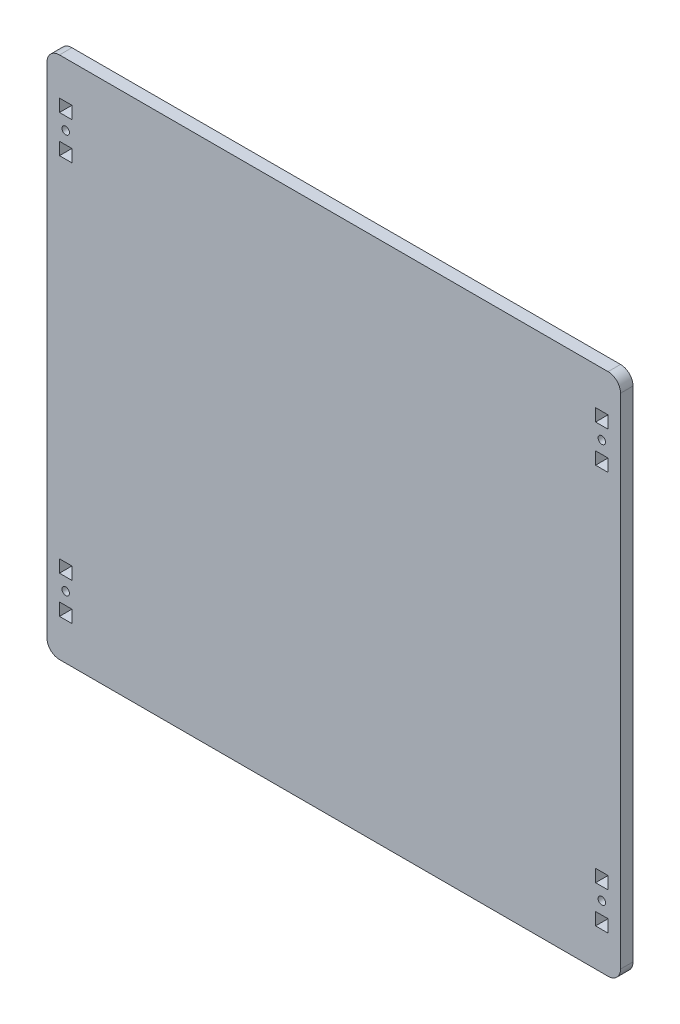
from build123d import *

# Parameters (mm, degrees)
ESQUISSE1_W        = 230
ESQUISSE1_H        = 210
ESQUISSE1_R        = 1.5
ESQUISSE1_W_2      = 5
ESQUISSE1_H_2      = 5
BOSS_EXTRU_1_DEPTH = 5
CONG_1_R           = 5


with BuildPart() as part:
    # Esquisse1 → Boss.-Extru.1 (new body)
    with BuildSketch(Plane.XY):
        Rectangle(ESQUISSE1_W, ESQUISSE1_H)
        with Locations((107.5, 80)):
            Circle(ESQUISSE1_R, mode=Mode.SUBTRACT)
        with Locations((107.5, -80)):
            Circle(ESQUISSE1_R, mode=Mode.SUBTRACT)
        with Locations(Location((-107.5, -80, 0), (0, 0, 180))):
            Circle(ESQUISSE1_R, mode=Mode.SUBTRACT)
        with Locations(Location((-107.5, 80, 0), (0, 0, 180))):
            Circle(ESQUISSE1_R, mode=Mode.SUBTRACT)
        with Locations((107.5, 72.5)):
            Rectangle(ESQUISSE1_W_2, ESQUISSE1_H_2, mode=Mode.SUBTRACT)
        with Locations((107.5, 87.5)):
            Rectangle(ESQUISSE1_W_2, ESQUISSE1_H_2, mode=Mode.SUBTRACT)
        with Locations((107.5, -87.5)):
            Rectangle(ESQUISSE1_W_2, ESQUISSE1_H_2, mode=Mode.SUBTRACT)
        with Locations((107.5, -72.5)):
            Rectangle(ESQUISSE1_W_2, ESQUISSE1_H_2, mode=Mode.SUBTRACT)
        with Locations((-107.5, -87.5)):
            Rectangle(ESQUISSE1_W_2, ESQUISSE1_H_2, mode=Mode.SUBTRACT)
        with Locations((-107.5, -72.5)):
            Rectangle(ESQUISSE1_W_2, ESQUISSE1_H_2, mode=Mode.SUBTRACT)
        with Locations((-107.5, 72.5)):
            Rectangle(ESQUISSE1_W_2, ESQUISSE1_H_2, mode=Mode.SUBTRACT)
        with Locations((-107.5, 87.5)):
            Rectangle(ESQUISSE1_W_2, ESQUISSE1_H_2, mode=Mode.SUBTRACT)
    extrude(amount=BOSS_EXTRU_1_DEPTH)

    # Congé1
    cong_1_edges = [part.edges().sort_by_distance(p)[0] for p in [
        (-115, 105, 2.5),
        (115, 105, 2.5),
        (115, -105, 2.5),
        (-115, -105, 2.5),
    ]]
    fillet(cong_1_edges, radius=CONG_1_R)


solid = part.part
